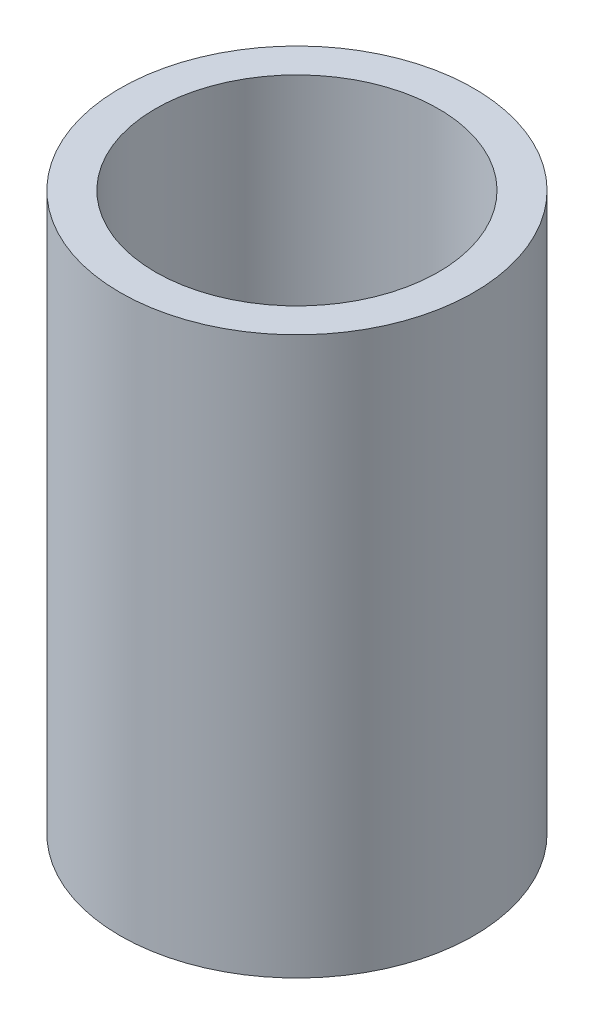
from build123d import *

# Parameters (mm, degrees)
SKETCH1_R           = 15.875
SKETCH1_R_2         = 12.7
BOSS_EXTRUDE1_DEPTH = 50


with BuildPart() as part:
    # Sketch1 → Boss-Extrude1 (new body)
    with BuildSketch(Plane(origin=(0, 0, 0), x_dir=(1, 0, 0), z_dir=(0, 1, 0))):
        with Locations(Location((0, 0, 0), (0, 0, 270))):
            Circle(SKETCH1_R)
        with Locations(Location((0, 0, 0), (0, 0, 270))):
            Circle(SKETCH1_R_2, mode=Mode.SUBTRACT)
    extrude(amount=BOSS_EXTRUDE1_DEPTH)


solid = part.part
